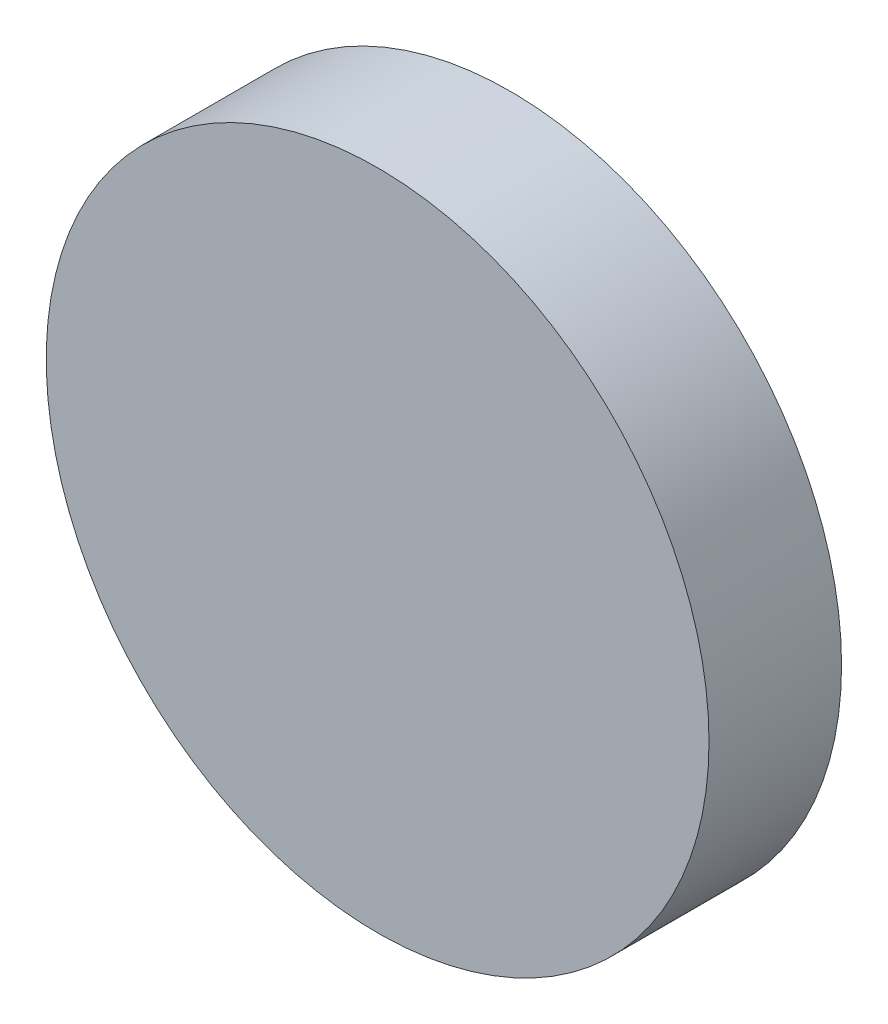
from build123d import *

# Parameters (mm, degrees)
ESQUISSE2_R        = 2.5
BOSS_EXTRU_1_DEPTH = 0.5


with BuildPart() as part:
    # Esquisse2 → Boss.-Extru.1 (new, symmetric)
    with BuildSketch(Plane.XY):
        Circle(ESQUISSE2_R)
    extrude(amount=BOSS_EXTRU_1_DEPTH, both=True)


solid = part.part
